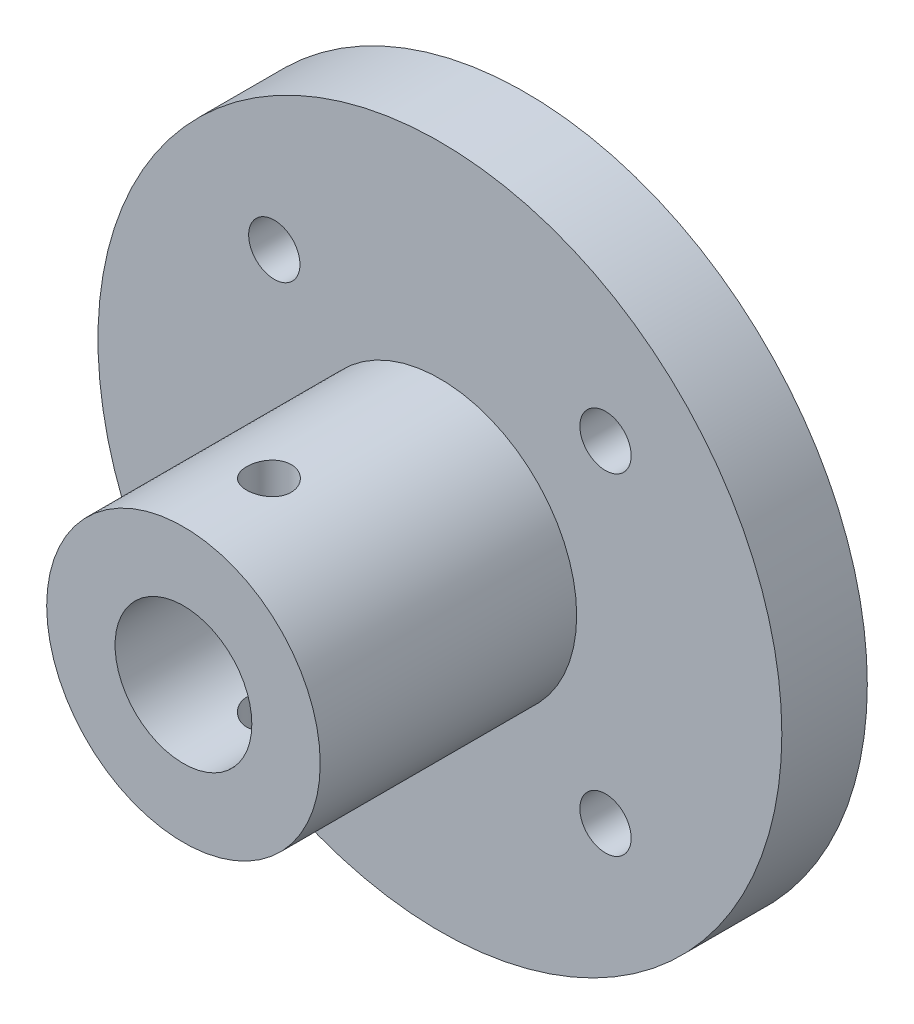
from build123d import *

# Parameters (mm, degrees)
SKETCH1_R               = 20
SKETCH1_R_2             = 4
SKETCH1_R_3             = 1.5
BOSS_EXTRUDE1_DEPTH     = 5
SKETCH2_R               = 8
SKETCH2_R_2             = 4
BOSS_EXTRUDE2_DEPTH     = 15
CUT_EXTRUDE1_DEPTH      = 35.641016151
CUT_EXTRUDE1_DEPTH_BACK = 35.641016151
SKETCH3_R               = 1.301925598


with BuildPart() as part:
    # Sketch1 → Boss-Extrude1 (new body)
    with BuildSketch(Plane.XY):
        Circle(SKETCH1_R)
        Circle(SKETCH1_R_2, mode=Mode.SUBTRACT)
        with Locations((-9.686203462, 9.686203462)):
            Circle(SKETCH1_R_3, mode=Mode.SUBTRACT)
        with Locations(Location((9.686203462, 9.686203462, 0), (0, 0, 180))):
            Circle(SKETCH1_R_3, mode=Mode.SUBTRACT)
        with Locations((9.686203462, -9.686203462)):
            Circle(SKETCH1_R_3, mode=Mode.SUBTRACT)
        with Locations(Location((-9.686203462, -9.686203462, 0), (0, 0, 180))):
            Circle(SKETCH1_R_3, mode=Mode.SUBTRACT)
    extrude(amount=BOSS_EXTRUDE1_DEPTH)

    # Sketch2 → Boss-Extrude2 (add)
    with BuildSketch(Plane.XY.offset(5)):
        Circle(SKETCH2_R)
        Circle(SKETCH2_R_2, mode=Mode.SUBTRACT)
    extrude(amount=BOSS_EXTRUDE2_DEPTH)

    # Sketch3 → Cut-Extrude1 (cut, two sides: drawn at the far end of the back side and taken through both)
    with BuildSketch(Plane(origin=(0, 0, 0), x_dir=(1, 0, 0), z_dir=(0, 1, 0)).offset(-CUT_EXTRUDE1_DEPTH_BACK)):
        with Locations(Location((0, -15, 0), (0, 0, 270))):
            Circle(SKETCH3_R)
    extrude(amount=CUT_EXTRUDE1_DEPTH + CUT_EXTRUDE1_DEPTH_BACK, mode=Mode.SUBTRACT)


solid = part.part
